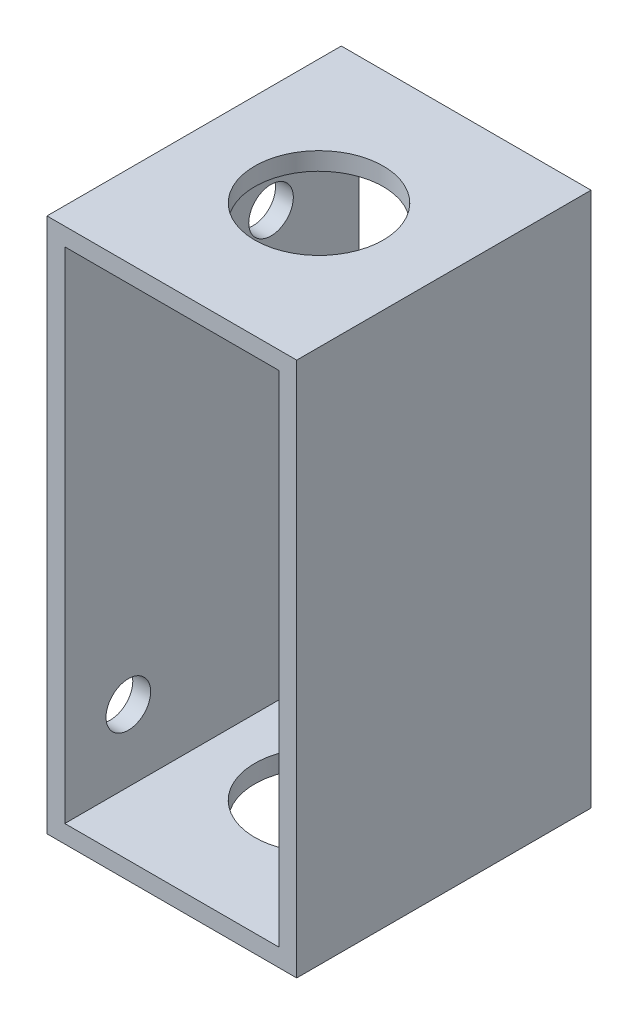
from build123d import *

# Parameters (mm, degrees)
SKETCH1_W               = 14
SKETCH1_H               = 30
BOSS_EXTRUDE1_DEPTH     = 16.5
CUT_EXTRUDE3_DEPTH      = 37.989863476
CUT_EXTRUDE3_DEPTH_BACK = 37.989863476
SKETCH3_OUTSIDE_W       = 23.398
SKETCH3_OUTSIDE_H       = 39.398
SKETCH3_OUTSIDE_W_2     = 14
SKETCH3_OUTSIDE_H_2     = 30
SKETCH3_OUTSIDE_W_3     = 12
SKETCH3_OUTSIDE_H_3     = 28
CUT_EXTRUDE4_DEPTH      = 37.989863476
CUT_EXTRUDE4_DEPTH_BACK = 16.5
SKETCH4_R               = 3.6
SKETCH5_R               = 1.25
CUT_EXTRUDE6_DEPTH      = 1


with BuildPart() as part:
    # Sketch1 → Boss-Extrude1 (new body)
    with BuildSketch(Plane.XY):
        with Locations((7, 15)):
            Rectangle(SKETCH1_W, SKETCH1_H)
    extrude(amount=BOSS_EXTRUDE1_DEPTH)

    # Sketch3 outside → Cut-Extrude3 (cut, two sides: drawn at the far end of the back side and taken through both)
    # profile 1 of 2: a face of its own
    with BuildSketch(Plane.XY.offset(-CUT_EXTRUDE3_DEPTH_BACK)):
        with Locations((7, 15)):
            Rectangle(SKETCH3_OUTSIDE_W, SKETCH3_OUTSIDE_H)
        with Locations((7, 15)):
            Rectangle(SKETCH3_OUTSIDE_W_2, SKETCH3_OUTSIDE_H_2, mode=Mode.SUBTRACT)
    # profile 2 of 2: a face of its own
    with BuildSketch(Plane.XY.offset(-CUT_EXTRUDE3_DEPTH_BACK)):
        with Locations((7, 15)):
            Rectangle(SKETCH3_OUTSIDE_W_3, SKETCH3_OUTSIDE_H_3)
    extrude(amount=CUT_EXTRUDE3_DEPTH + CUT_EXTRUDE3_DEPTH_BACK, mode=Mode.SUBTRACT)

    # Sketch4 → Cut-Extrude4 (cut, two sides: drawn at the far end of the back side and taken through both)
    with BuildSketch(Plane(origin=(0, 0, 0), x_dir=(1, 0, 0), z_dir=(0, 1, 0)).offset(-CUT_EXTRUDE4_DEPTH_BACK)):
        with Locations((7, -8.25)):
            Circle(SKETCH4_R)
    extrude(amount=CUT_EXTRUDE4_DEPTH + CUT_EXTRUDE4_DEPTH_BACK, mode=Mode.SUBTRACT)

    # Sketch5 → Cut-Extrude6 (cut)
    with BuildSketch(Plane(origin=(0, 0, 0), x_dir=(0, 0, -1), z_dir=(1, 0, 0))):
        with Locations(Location((-4.939666778, 25, 0), (0, 0, 180))):
            Circle(SKETCH5_R)
        with Locations(Location((-12.939666778, 5, 0), (0, 0, 180))):
            Circle(SKETCH5_R)
    extrude(amount=CUT_EXTRUDE6_DEPTH, mode=Mode.SUBTRACT)


solid = part.part
